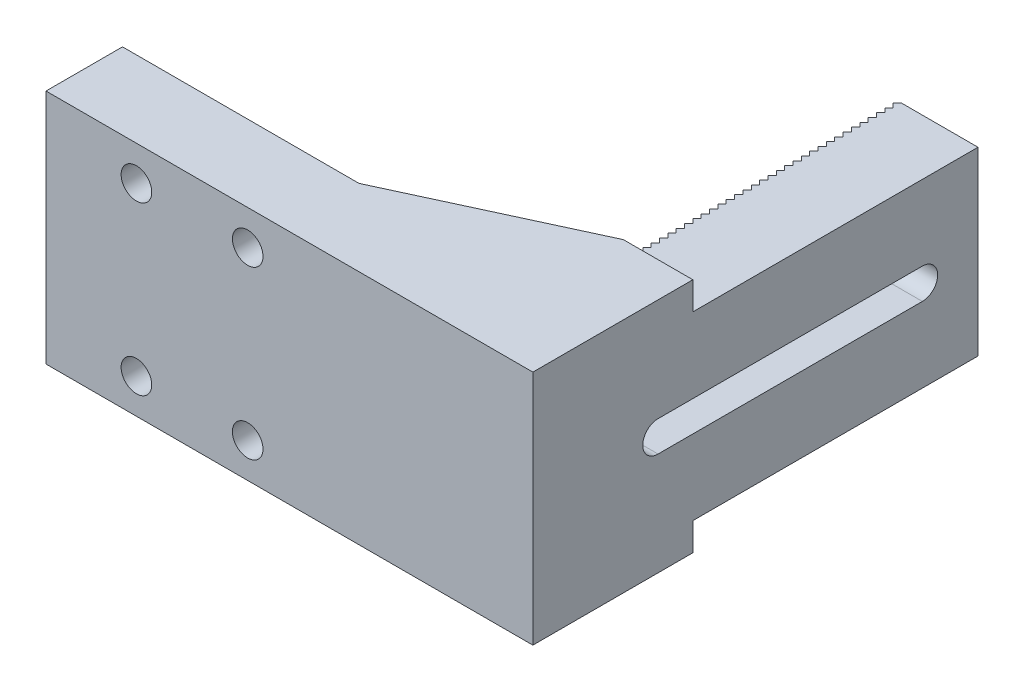
from build123d import *

# Parameters (mm, degrees)
EXTRUDE_1_DEPTH          = 17
SKETCH_4_R               = 1.1
CUT_EXTRUDE_2_DEPTH      = 51.378566871
SKETCH_8_W               = 20.5
SKETCH_8_H               = 2
CUT_EXTRUDE_5_DEPTH      = 48.042533945
EXTRUDE_2_DEPTH          = 13
CUT_EXTRUDE_4_DEPTH      = 10
CUT_EXTRUDE_4_DEPTH_BACK = 48.042533945
EXTRUDE_3_DEPTH          = 2
EXTRUDE_4_DEPTH          = 2


with BuildPart() as part:
    # 草图1 → 凸台-拉伸1 (new body)
    with BuildSketch(Plane(origin=(0, 0, 0), x_dir=(1, 0, 0), z_dir=(0, 1, 0))):
        Polygon((0, 0), (-35, 0), (-35, 5.5), (-5, 5.5), (-5, 32), (0, 32), align=None)
    extrude(amount=EXTRUDE_1_DEPTH)

    # 草图4 → 切除-拉伸2 (cut, through all)
    with BuildSketch(Plane.XY):
        with Locations((-28.5, 14.5)):
            Circle(SKETCH_4_R)
        with Locations((-20.5, 14.5)):
            Circle(SKETCH_4_R)
        with Locations((-28.5, 2.5)):
            Circle(SKETCH_4_R)
        with Locations((-20.5, 2.5)):
            Circle(SKETCH_4_R)
    extrude(amount=-CUT_EXTRUDE_2_DEPTH, mode=Mode.SUBTRACT)

    # 草图8 → 切除-拉伸5 (cut, through all)
    with BuildSketch(Plane.ZY.offset(5)):
        with Locations((-21.75, 16)):
            Rectangle(SKETCH_8_W, SKETCH_8_H)
        with Locations((-21.75, 1)):
            Rectangle(SKETCH_8_W, SKETCH_8_H)
    extrude(amount=-CUT_EXTRUDE_5_DEPTH, mode=Mode.SUBTRACT)

    # 草图11 → 凸台-拉伸2 (add)
    with BuildSketch(Plane.XZ.offset(-2)):
        Polygon((-5, -5.5), (-5, -32), (-5.5, -32), (-5.8, -31.7), (-5.5, -31.4), (-5.8, -31.1), (-5.5, -30.8), (-5.8, -30.5), (-5.5, -30.2), (-5.8, -29.9), (-5.5, -29.6), (-5.8, -29.3), (-5.5, -29), (-5.8, -28.7), (-5.5, -28.4), (-5.8, -28.1), (-5.5, -27.8), (-5.8, -27.5), (-5.5, -27.2), (-5.8, -26.9), (-5.5, -26.6), (-5.8, -26.3), (-5.5, -26), (-5.8, -25.7), (-5.5, -25.4), (-5.8, -25.1), (-5.5, -24.8), (-5.8, -24.5), (-5.5, -24.2), (-5.8, -23.9), (-5.5, -23.6), (-5.8, -23.3), (-5.5, -23), (-5.8, -22.7), (-5.5, -22.4), (-5.8, -22.1), (-5.5, -21.8), (-5.8, -21.5), (-5.5, -21.2), (-5.8, -20.9), (-5.5, -20.6), (-5.8, -20.3), (-5.5, -20), (-5.8, -19.7), (-5.5, -19.4), (-5.8, -19.1), (-5.5, -18.8), (-5.8, -18.5), (-5.5, -18.2), (-5.8, -17.9), (-5.5, -17.6), (-5.8, -17.3), (-5.5, -17), (-5.8, -16.7), (-5.5, -16.4), (-5.8, -16.1), (-5.5, -15.8), (-5.8, -15.5), (-5.5, -15.2), (-5.8, -14.9), (-5.5, -14.6), (-5.8, -14.3), (-5.5, -14), (-5.8, -13.7), (-5.5, -13.4), (-5.8, -13.1), (-5.5, -12.8), (-5.8, -12.5), (-5.5, -12.2), (-5.8, -11.9), (-5.5, -11.6), (-5.8, -11.3), (-5.5, -11), (-5.8, -10.7), (-5.5, -10.4), (-5.8, -10.1), (-5.5, -9.8), (-5.8, -9.5), (-5.5, -9.2), (-5.8, -8.9), (-5.5, -8.6), (-5.8, -8.3), (-5.5, -8), (-5.8, -7.7), (-5.5, -7.4), (-5.8, -7.1), (-5.5, -6.8), (-5.8, -6.5), (-5.5, -6.2), (-5.5, -5.5), align=None)
    extrude(amount=-EXTRUDE_2_DEPTH)

    # 草图6 → 切除-拉伸4 (cut, two sides: drawn at the far end of the back side and taken through both)
    with BuildSketch(Plane.ZY.offset(5).offset(-CUT_EXTRUDE_4_DEPTH_BACK)):
        with BuildLine():
            Line((-28, 9.6), (-9, 9.6))
            ThreePointArc((-9, 9.6), (-7.9, 8.5), (-9, 7.4))
            Line((-9, 7.4), (-28, 7.4))
            ThreePointArc((-28, 7.4), (-29.1, 8.5), (-28, 9.6))
        make_face()
    extrude(amount=CUT_EXTRUDE_4_DEPTH + CUT_EXTRUDE_4_DEPTH_BACK, mode=Mode.SUBTRACT)

    # 草图12 → 凸台-拉伸3 (add)
    with BuildSketch(Plane.XZ):
        Polygon((-5, -11.5), (-5, -5.5), (-18, -5.5), align=None)
    extrude(amount=-EXTRUDE_3_DEPTH)

    # 草图13 → 凸台-拉伸4 (add)
    with BuildSketch(Plane(origin=(0, 17, 0), x_dir=(1, 0, 0), z_dir=(0, 1, 0))):
        Polygon((-5, 11.5), (-5, 5.5), (-18, 5.5), align=None)
    extrude(amount=-EXTRUDE_4_DEPTH)


solid = part.part
